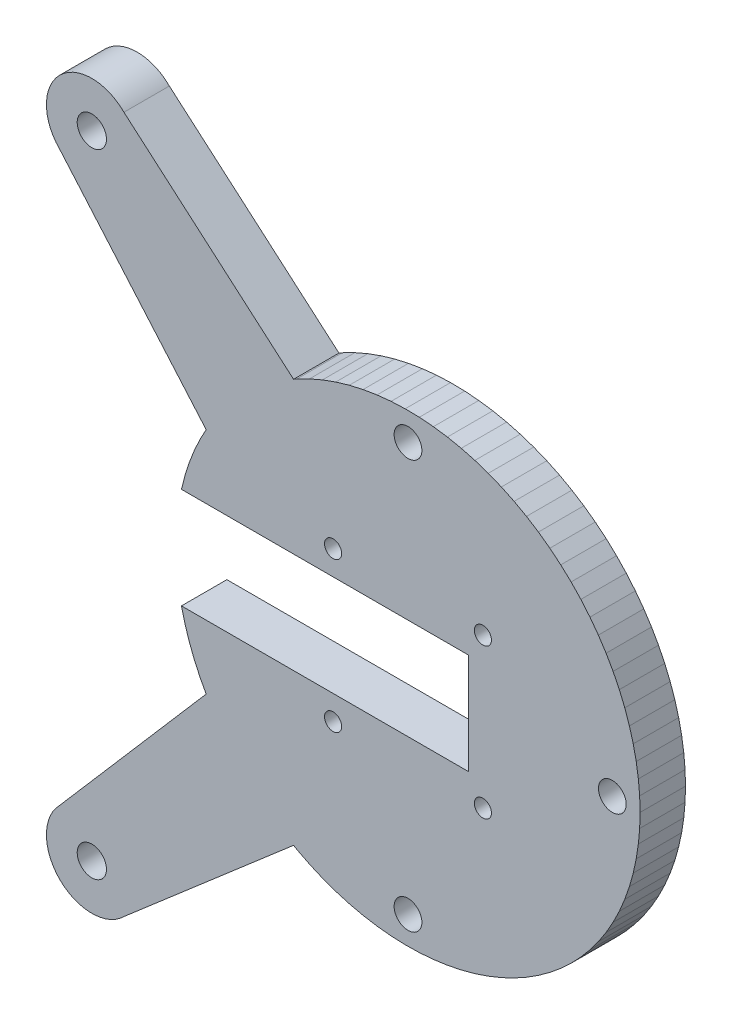
from build123d import *

# Parameters (mm, degrees)
SKETCH_1_R          = 3.75
SKETCH_1_R_2        = 2.75
EXTRUDE_436_DEPTH   = 4
EXTRUDE_START       = 4
SKETCH_2_R          = 1.7
SKETCH_2_R_2        = 2.75
EXTRUDE_712_DEPTH   = 5
SKETCH_3_R          = 2.9
EXTRUDE_5_8_DEPTH   = 9
SKETCH_4_R          = 2.9
EXTRUDE_5_8_2_DEPTH = 9


with BuildPart() as part:
    # 草图1 → Extrude 436 (new body)
    with BuildSketch(Plane.XY):
        Polygon((-44.899888641, -10), (-44.2082264, -12.713485699), (-43.352738806, -15.379858192), (-42.336596099, -17.989236526), (-41.163563864, -20.531950955), (-39.837989085, -22.998578775), (-38.364784033, -25.379979238), (-36.74940806, -27.667327432), (-34.997847373, -29.852146979), (-33.116592846, -31.926341448), (-31.112615968, -33.882224361), (-28.993343009, -35.712547671), (-26.7666275, -37.410528629), (-24.440721127, -38.969874914), (-22.024243155, -40.384807953), (-19.526148488, -41.650084336), (-16.955694479, -42.761015244), (-14.322406631, -43.713483827), (-11.636043292, -44.503960459), (-8.906559497, -45.129515818), (-6.144070075, -45.587831742), (-3.358812166, -45.87720982), (-0.561107284, -45.996577684), (2.238676931, -45.945492985), (5.030165132, -45.72414503), (7.803012717, -45.333354084), (10.546944161, -44.774568327), (13.251791096, -44.049858487), (15.907529991, -43.161910171), (18.504319299, -42.114013906), (21.032535927, -40.910052952), (23.482810893, -39.554488905), (25.846064052, -38.052345171), (28.11353774, -36.409188342), (30.276829231, -34.631107573), (32.327921871, -32.724692016), (34.25921479, -30.697006401), (36.063551069, -28.555564857), (37.734244259, -26.308303066), (39.265103162, -23.963548854), (40.650454772, -21.529991333), (41.885165301, -19.016648698), (42.9646592, -16.432834808), (43.884936117, -13.788124675), (44.64258572, -11.092318975), (45.234800338, -8.355407734), (45.659385361, -5.587533306), (45.914767377, -2.798952785), (46, 0), (45.914767377, 2.798952785), (45.659385361, 5.587533306), (45.234800338, 8.355407734), (44.64258572, 11.092318975), (43.884936117, 13.788124675), (42.9646592, 16.432834808), (41.885165301, 19.016648698), (40.650454772, 21.529991333), (39.265103162, 23.963548854), (37.734244259, 26.308303066), (36.063551069, 28.555564857), (34.25921479, 30.697006401), (32.327921871, 32.724692016), (30.276829231, 34.631107573), (28.11353774, 36.409188342), (25.846064052, 38.052345171), (23.482810893, 39.554488905), (21.032535927, 40.910052952), (18.504319299, 42.114013906), (15.907529991, 43.161910171), (13.251791096, 44.049858487), (10.546944161, 44.774568327), (7.803012717, 45.333354084), (5.030165132, 45.72414503), (2.238676931, 45.945492985), (-0.561107284, 45.996577684), (-3.358812166, 45.87720982), (-6.144070075, 45.587831742), (-8.906559497, 45.129515818), (-11.636043292, 44.503960459), (-14.322406631, 43.713483827), (-16.955694479, 42.761015244), (-19.526148488, 41.650084336), (-22.024243155, 40.384807953), (-24.440721127, 38.969874914), (-26.7666275, 37.410528629), (-28.993343009, 35.712547671), (-31.112615968, 33.882224361), (-33.116592846, 31.926341448), (-34.997847373, 29.852146979), (-36.74940806, 27.667327432), (-38.364784033, 25.379979238), (-39.837989085, 22.998578775), (-41.163563864, 20.531950955), (-42.336596099, 17.989236526), (-43.352738806, 15.379858192), (-44.2082264, 12.713485699), (-44.899888641, 10), (12, 10), (12, -10), align=None)
        with Locations((-14.845, -14.845)):
            Circle(SKETCH_1_R, mode=Mode.SUBTRACT)
        with Locations((-14.845, 14.845)):
            Circle(SKETCH_1_R, mode=Mode.SUBTRACT)
        with Locations((14.845, -14.845)):
            Circle(SKETCH_1_R, mode=Mode.SUBTRACT)
        with Locations((14.845, 14.845)):
            Circle(SKETCH_1_R, mode=Mode.SUBTRACT)
        with Locations((0, -40.5)):
            Circle(SKETCH_1_R_2, mode=Mode.SUBTRACT)
        with Locations((0, 40.5)):
            Circle(SKETCH_1_R_2, mode=Mode.SUBTRACT)
        with Locations((40.5, 0)):
            Circle(SKETCH_1_R_2, mode=Mode.SUBTRACT)
    extrude(amount=EXTRUDE_436_DEPTH)

    # 草图2 → Extrude 712 (add)
    with BuildSketch(Plane.XY.offset(EXTRUDE_START)):
        Polygon((-44.899888641, -10), (-44.2082264, -12.713485699), (-43.352738806, -15.379858192), (-42.336596099, -17.989236526), (-41.163563864, -20.531950955), (-39.837989085, -22.998578775), (-38.364784033, -25.379979238), (-36.74940806, -27.667327432), (-34.997847373, -29.852146979), (-33.116592846, -31.926341448), (-31.112615968, -33.882224361), (-28.993343009, -35.712547671), (-26.7666275, -37.410528629), (-24.440721127, -38.969874914), (-22.024243155, -40.384807953), (-19.526148488, -41.650084336), (-16.955694479, -42.761015244), (-14.322406631, -43.713483827), (-11.636043292, -44.503960459), (-8.906559497, -45.129515818), (-6.144070075, -45.587831742), (-3.358812166, -45.87720982), (-0.561107284, -45.996577684), (2.238676931, -45.945492985), (5.030165132, -45.72414503), (7.803012717, -45.333354084), (10.546944161, -44.774568327), (13.251791096, -44.049858487), (15.907529991, -43.161910171), (18.504319299, -42.114013906), (21.032535927, -40.910052952), (23.482810893, -39.554488905), (25.846064052, -38.052345171), (28.11353774, -36.409188342), (30.276829231, -34.631107573), (32.327921871, -32.724692016), (34.25921479, -30.697006401), (36.063551069, -28.555564857), (37.734244259, -26.308303066), (39.265103162, -23.963548854), (40.650454772, -21.529991333), (41.885165301, -19.016648698), (42.9646592, -16.432834808), (43.884936117, -13.788124675), (44.64258572, -11.092318975), (45.234800338, -8.355407734), (45.659385361, -5.587533306), (45.914767377, -2.798952785), (46, 0), (45.914767377, 2.798952785), (45.659385361, 5.587533306), (45.234800338, 8.355407734), (44.64258572, 11.092318975), (43.884936117, 13.788124675), (42.9646592, 16.432834808), (41.885165301, 19.016648698), (40.650454772, 21.529991333), (39.265103162, 23.963548854), (37.734244259, 26.308303066), (36.063551069, 28.555564857), (34.25921479, 30.697006401), (32.327921871, 32.724692016), (30.276829231, 34.631107573), (28.11353774, 36.409188342), (25.846064052, 38.052345171), (23.482810893, 39.554488905), (21.032535927, 40.910052952), (18.504319299, 42.114013906), (15.907529991, 43.161910171), (13.251791096, 44.049858487), (10.546944161, 44.774568327), (7.803012717, 45.333354084), (5.030165132, 45.72414503), (2.238676931, 45.945492985), (-0.561107284, 45.996577684), (-3.358812166, 45.87720982), (-6.144070075, 45.587831742), (-8.906559497, 45.129515818), (-11.636043292, 44.503960459), (-14.322406631, 43.713483827), (-16.955694479, 42.761015244), (-19.526148488, 41.650084336), (-22.024243155, 40.384807953), (-24.440721127, 38.969874914), (-26.7666275, 37.410528629), (-28.993343009, 35.712547671), (-31.112615968, 33.882224361), (-33.116592846, 31.926341448), (-34.997847373, 29.852146979), (-36.74940806, 27.667327432), (-38.364784033, 25.379979238), (-39.837989085, 22.998578775), (-41.163563864, 20.531950955), (-42.336596099, 17.989236526), (-43.352738806, 15.379858192), (-44.2082264, 12.713485699), (-44.899888641, 10), (12, 10), (12, -10), align=None)
        with Locations((-14.845, -14.845)):
            Circle(SKETCH_2_R, mode=Mode.SUBTRACT)
        with Locations((-14.845, 14.845)):
            Circle(SKETCH_2_R, mode=Mode.SUBTRACT)
        with Locations((14.845, -14.845)):
            Circle(SKETCH_2_R, mode=Mode.SUBTRACT)
        with Locations((14.845, 14.845)):
            Circle(SKETCH_2_R, mode=Mode.SUBTRACT)
        with Locations((0, -40.5)):
            Circle(SKETCH_2_R_2, mode=Mode.SUBTRACT)
        with Locations((0, 40.5)):
            Circle(SKETCH_2_R_2, mode=Mode.SUBTRACT)
        with Locations((40.5, 0)):
            Circle(SKETCH_2_R_2, mode=Mode.SUBTRACT)
    extrude(amount=EXTRUDE_712_DEPTH)

    # 草图3 → Extrude 5.8 (add)
    with BuildSketch(Plane.XY):
        with BuildLine():
            Line((-33.234018716, -14.849242405), (-69.028961031, -56.301038969))
            ThreePointArc((-69.028961031, -56.301038969), (-69.028961031, -69.028961031), (-56.301038969, -69.028961031))
            Line((-56.301038969, -69.028961031), (-14.849242405, -33.234018716))
            Line((-14.849242405, -33.234018716), (-33.234018716, -14.849242405))
        make_face()
        with Locations((-62.665, -62.665)):
            Circle(SKETCH_3_R, mode=Mode.SUBTRACT)
    extrude(amount=EXTRUDE_5_8_DEPTH)

    # 草图4 → Extrude 5.8 2 (add)
    with BuildSketch(Plane.XY):
        with BuildLine():
            Line((-14.849242405, 33.234018716), (-56.301038969, 69.028961031))
            ThreePointArc((-56.301038969, 69.028961031), (-69.028961031, 69.028961031), (-69.028961031, 56.301038969))
            Line((-69.028961031, 56.301038969), (-33.234018716, 14.849242405))
            Line((-33.234018716, 14.849242405), (-14.849242405, 33.234018716))
        make_face()
        with Locations((-62.665, 62.665)):
            Circle(SKETCH_4_R, mode=Mode.SUBTRACT)
    extrude(amount=EXTRUDE_5_8_2_DEPTH)


solid = part.part
